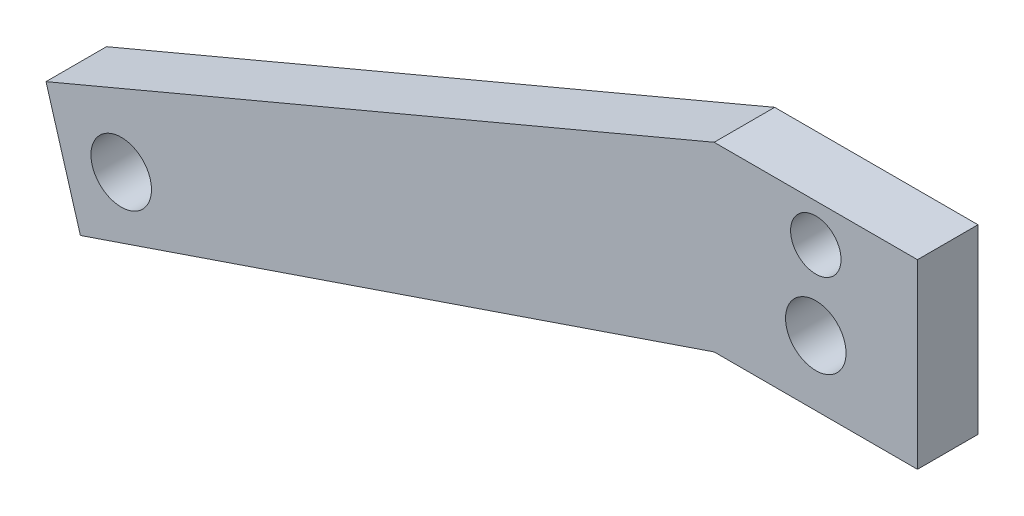
from build123d import *

# Parameters (mm, degrees)
SKETCH1_R           = 3.96875
SKETCH1_R_2         = 4.762500002
BOSS_EXTRUDE1_DEPTH = 9.525


with BuildPart() as part:
    # Sketch1 → Boss-Extrude1 (new body)
    with BuildSketch(Plane.XY):
        Polygon((-15.999993773, 44.99997758), (-121.1436315, 0.697282679), (-115.733139184, -17.56823327), (-15.999993773, 16.42497758), (16.000006227, 16.42497758), (16.000006227, 44.99997758), align=None)
        with Locations(Location((6.227e-06, 38.99997758, 0), (0, 0, 180))):
            Circle(SKETCH1_R, mode=Mode.SUBTRACT)
        with Locations(Location((6.239e-06, 26.647574613, 0), (0, 0, 180))):
            Circle(SKETCH1_R_2, mode=Mode.SUBTRACT)
        with Locations(Location((-109.305627368, -5.730229137, 0), (0, 0, 180))):
            Circle(SKETCH1_R_2, mode=Mode.SUBTRACT)
    extrude(amount=BOSS_EXTRUDE1_DEPTH)


solid = part.part
